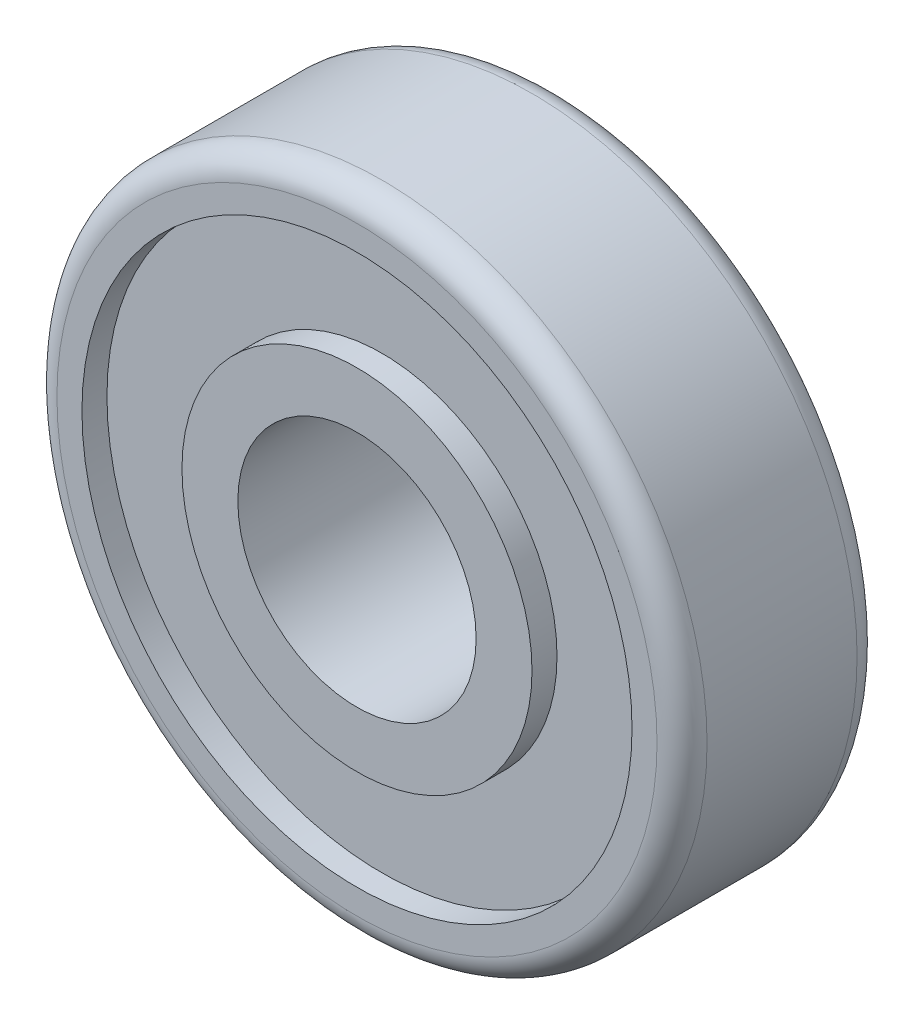
from build123d import *

# Parameters (mm, degrees)
ESBO_O1_R                = 13
ESBO_O1_R_2              = 4.765
RESSALTO_EXTRUS_O1_DEPTH = 8
ESBO_O2_R                = 11
ESBO_O2_R_2              = 7
CORTE_EXTRUS_O1_DEPTH    = 1
CORTE_EXTRUS_O2_START    = -1
ESBO_O3_R                = 11
ESBO_O3_R_2              = 7
CORTE_EXTRUS_O2_DEPTH    = 1
FILETE1_R                = 1


with BuildPart() as part:
    # Esboço1 → Ressalto-extrusão1 (new body)
    with BuildSketch(Plane.XY):
        Circle(ESBO_O1_R)
        Circle(ESBO_O1_R_2, mode=Mode.SUBTRACT)
    extrude(amount=RESSALTO_EXTRUS_O1_DEPTH)

    # Esboço2 → Corte-extrusão1 (cut)
    with BuildSketch(Plane.XY.offset(8)):
        Circle(ESBO_O2_R)
        Circle(ESBO_O2_R_2, mode=Mode.SUBTRACT)
    extrude(amount=-CORTE_EXTRUS_O1_DEPTH, mode=Mode.SUBTRACT)

    # Esboço3 → Corte-extrusão2 (cut)
    with BuildSketch(Plane(origin=(0, 0, 0), x_dir=(-1, 0, 0), z_dir=(0, 0, -1)).offset(CORTE_EXTRUS_O2_START)):
        with Locations(Location((0, 0, 0), (0, 0, 180))):
            Circle(ESBO_O3_R)
        with Locations(Location((0, 0, 0), (0, 0, 180))):
            Circle(ESBO_O3_R_2, mode=Mode.SUBTRACT)
    extrude(amount=CORTE_EXTRUS_O2_DEPTH, mode=Mode.SUBTRACT)

    # Filete1
    filete1_edges = [part.edges().sort_by_distance(p)[0] for p in [
        (-13, 0, 0),
        (-13, 0, 8),
    ]]
    fillet(filete1_edges, radius=FILETE1_R)


solid = part.part
